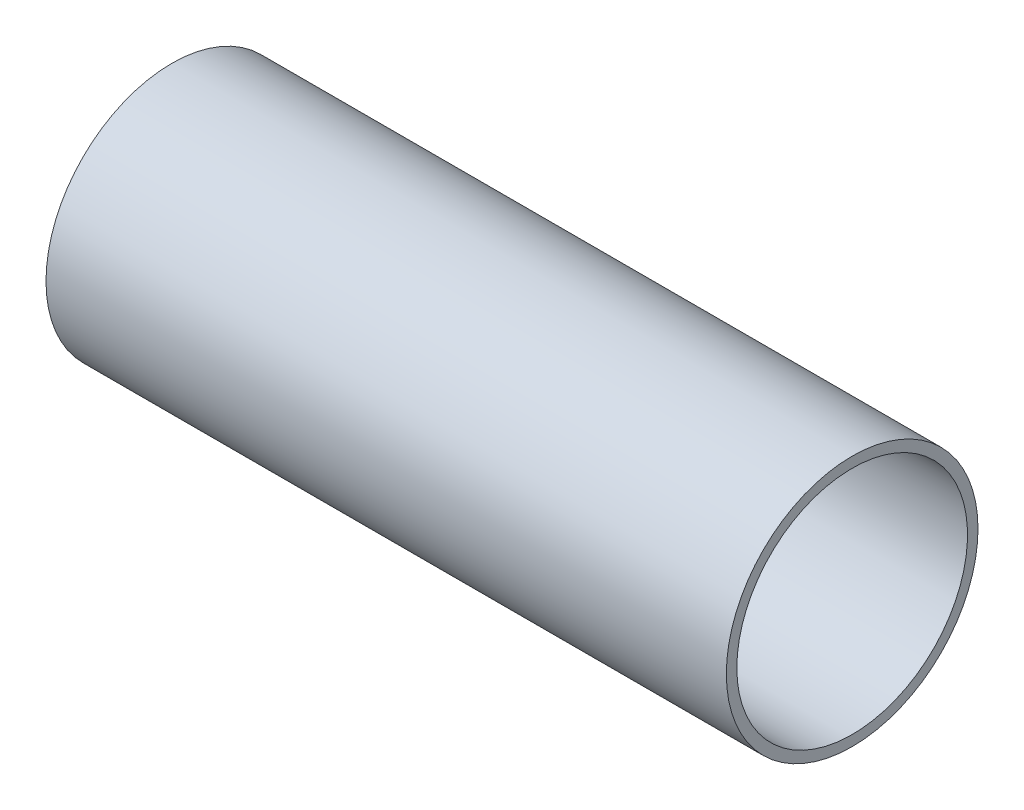
from build123d import *

# Parameters (mm, degrees)
SKETCH1_W = 412
SKETCH1_H = 6.35


with BuildPart() as part:
    # Sketch1 → Revolve1 (revolve)
    with BuildSketch(Plane.XY, mode=Mode.PRIVATE) as revolve1_sk:
        with Locations((0, 73.025)):
            Rectangle(SKETCH1_W, SKETCH1_H)
    revolve(revolve1_sk.sketch.rotate(Axis((0, 0, 0), (1, 0, 0)), 90), axis=Axis((0, 0, 0), (1, 0, 0)))


solid = part.part
